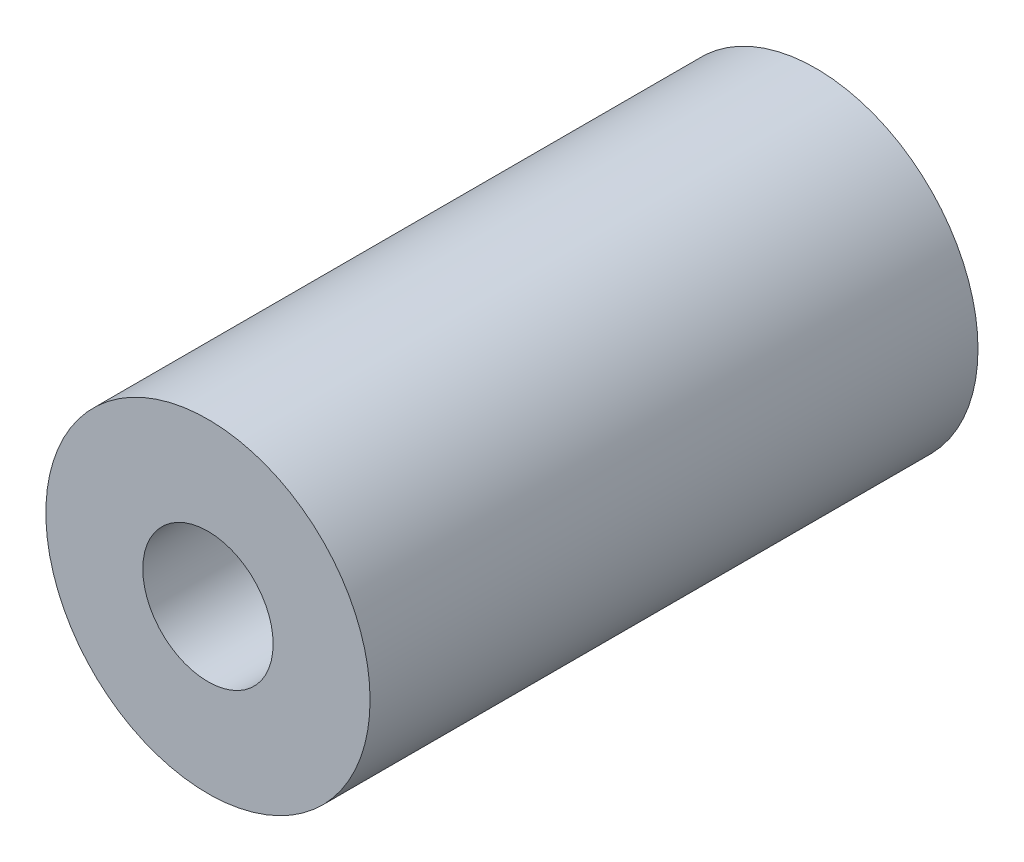
from build123d import *

# Parameters (mm, degrees)
SKETCH1_R                             = 6.35
BOSS_EXTRUDE1_DEPTH                   = 11.90625
F_1_4_20_TAPPED_HOLE1_D               = 5.1054
F_1_4_20_TAPPED_HOLE1_DEPTH           = 16.51
F_1_4_20_TAPPED_HOLE1_TIP             = 1.533816902
F_1_4_20_TAPPED_HOLE1_ON_FACE_2_D     = 5.1054
F_1_4_20_TAPPED_HOLE1_ON_FACE_2_DEPTH = 16.51
F_1_4_20_TAPPED_HOLE1_ON_FACE_2_TIP   = 1.533816902


with BuildPart() as part:
    # Sketch1 → Boss-Extrude1 (new, symmetric)
    with BuildSketch(Plane.XY):
        Circle(SKETCH1_R)
    extrude(amount=BOSS_EXTRUDE1_DEPTH, both=True)

    # 1/4-20 Tapped Hole1
    with Locations(Plane.XY.offset(11.90625)):
        with Locations((0, 0)):
            Hole(F_1_4_20_TAPPED_HOLE1_D / 2, depth=F_1_4_20_TAPPED_HOLE1_DEPTH)
            with Locations((0, 0, -(F_1_4_20_TAPPED_HOLE1_DEPTH + F_1_4_20_TAPPED_HOLE1_TIP / 2))):  # 118° drill point
                Cone(0, F_1_4_20_TAPPED_HOLE1_D / 2, F_1_4_20_TAPPED_HOLE1_TIP, mode=Mode.SUBTRACT)

    # 1/4-20 Tapped Hole1 on face 2
    with Locations(Plane(origin=(0, 0, -11.90625), x_dir=(-1, 0, 0), z_dir=(0, 0, -1))):
        with Locations((0, 0)):
            Hole(F_1_4_20_TAPPED_HOLE1_ON_FACE_2_D / 2, depth=F_1_4_20_TAPPED_HOLE1_ON_FACE_2_DEPTH)
            with Locations((0, 0, -(F_1_4_20_TAPPED_HOLE1_ON_FACE_2_DEPTH + F_1_4_20_TAPPED_HOLE1_ON_FACE_2_TIP / 2))):  # 118° drill point
                Cone(0, F_1_4_20_TAPPED_HOLE1_ON_FACE_2_D / 2, F_1_4_20_TAPPED_HOLE1_ON_FACE_2_TIP, mode=Mode.SUBTRACT)


solid = part.part
